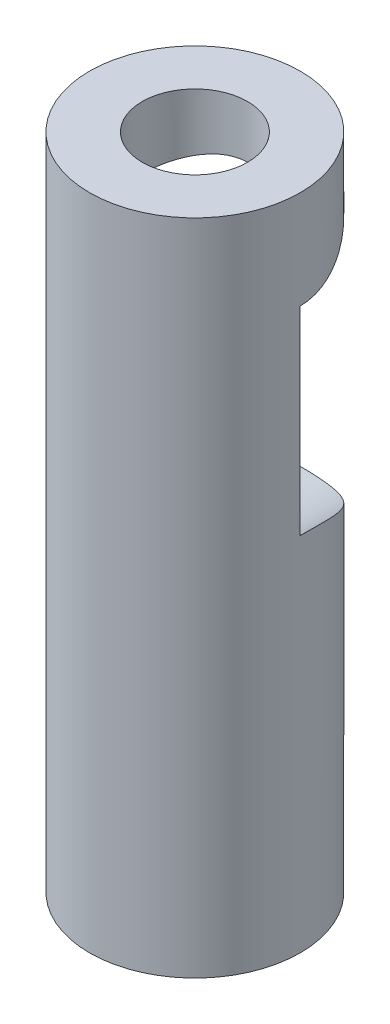
from build123d import *

# Parameters (mm, degrees)
ESQUISSE1_R             = 8
ESQUISSE1_R_2           = 4
BOSS_EXTRU_1_DEPTH      = 30
ESQUISSE2_R             = 11
ENL_V_MAT_EXTRU_1_DEPTH = 33.062439084
BOSS_EXTRU_2_START      = 20
ESQUISSE3_R             = 8
ESQUISSE3_R_2           = 4
BOSS_EXTRU_2_DEPTH      = 20


with BuildPart() as part:
    # Esquisse1 → Boss.-Extru.1 (new body)
    with BuildSketch(Plane(origin=(0, 0, 0), x_dir=(1, 0, 0), z_dir=(0, 1, 0))):
        with Locations(Location((0, 0, 0), (0, 0, 270))):
            Circle(ESQUISSE1_R)
        with Locations(Location((0, 0, 0), (0, 0, 270))):
            Circle(ESQUISSE1_R_2, mode=Mode.SUBTRACT)
    extrude(amount=BOSS_EXTRU_1_DEPTH)

    # Esquisse2 → Enlèv. mat.-Extru.1 (cut, through all)
    with BuildSketch(Plane.XY):
        with Locations((0, 15)):
            Circle(ESQUISSE2_R)
    extrude(amount=-ENL_V_MAT_EXTRU_1_DEPTH, mode=Mode.SUBTRACT)

    # Esquisse3 → Boss.-Extru.2 (add)
    with BuildSketch(Plane.XZ.offset(BOSS_EXTRU_2_START)):
        with Locations(Location((0, 0, 0), (0, 0, 270))):
            Circle(ESQUISSE3_R)
        with Locations(Location((0, 0, 0), (0, 0, 270))):
            Circle(ESQUISSE3_R_2, mode=Mode.SUBTRACT)
    extrude(amount=-BOSS_EXTRU_2_DEPTH)


solid = part.part
